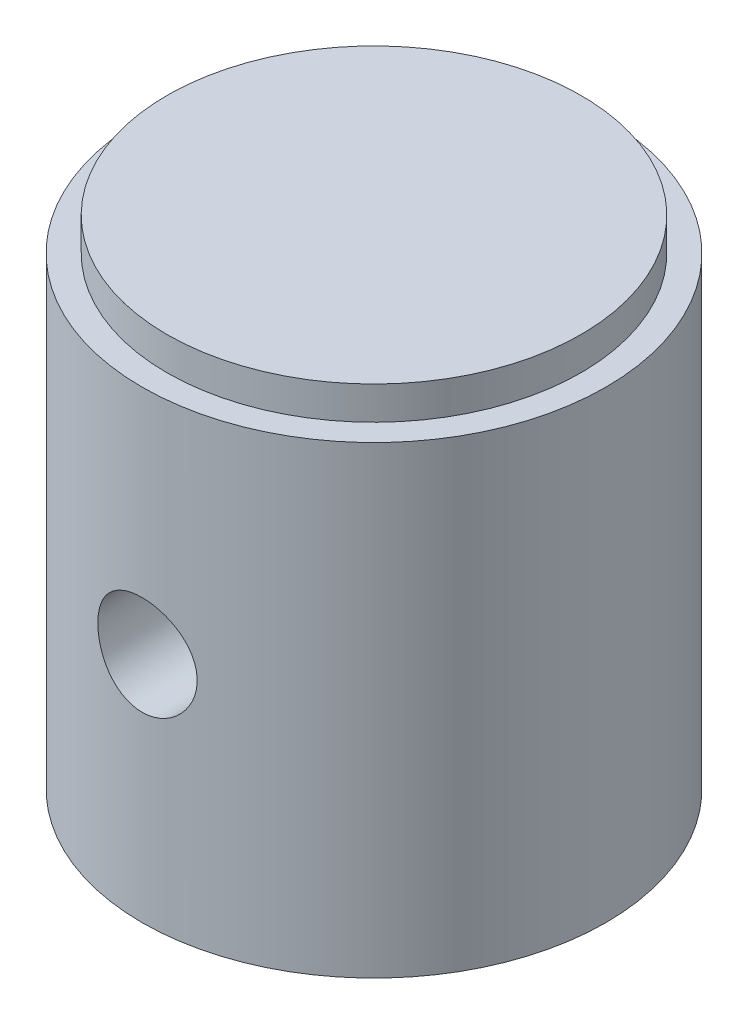
from build123d import *

# Parameters (mm, degrees)
CUT_EXTRUDE1_DEPTH      = 13.727922061
CUT_EXTRUDE1_DEPTH_BACK = 13.727922061
SKETCH3_R               = 1.5


with BuildPart() as part:
    # Sketch2 → Revolve1 (revolve)
    with BuildSketch(Plane.XY, mode=Mode.PRIVATE) as revolve1_sk:
        Polygon((-6.2, -7), (-4.75, -3.016157742), (-4.75, 4), (0, 6.85408794), (0, 8), (-6.25, 8), (-6.25, 7), (-7, 7), (-7, -7), align=None)
    revolve(revolve1_sk.sketch.rotate(Axis((0, 19.6875, 0), (0, -1, 0)), 270), axis=Axis((0, 19.6875, 0), (0, -1, 0)))

    # Sketch3 → Cut-Extrude1 (cut, two sides: drawn at the far end of the back side and taken through both)
    with BuildSketch(Plane.XY.offset(-CUT_EXTRUDE1_DEPTH_BACK)):
        Circle(SKETCH3_R)
    extrude(amount=CUT_EXTRUDE1_DEPTH + CUT_EXTRUDE1_DEPTH_BACK, mode=Mode.SUBTRACT)


solid = part.part
